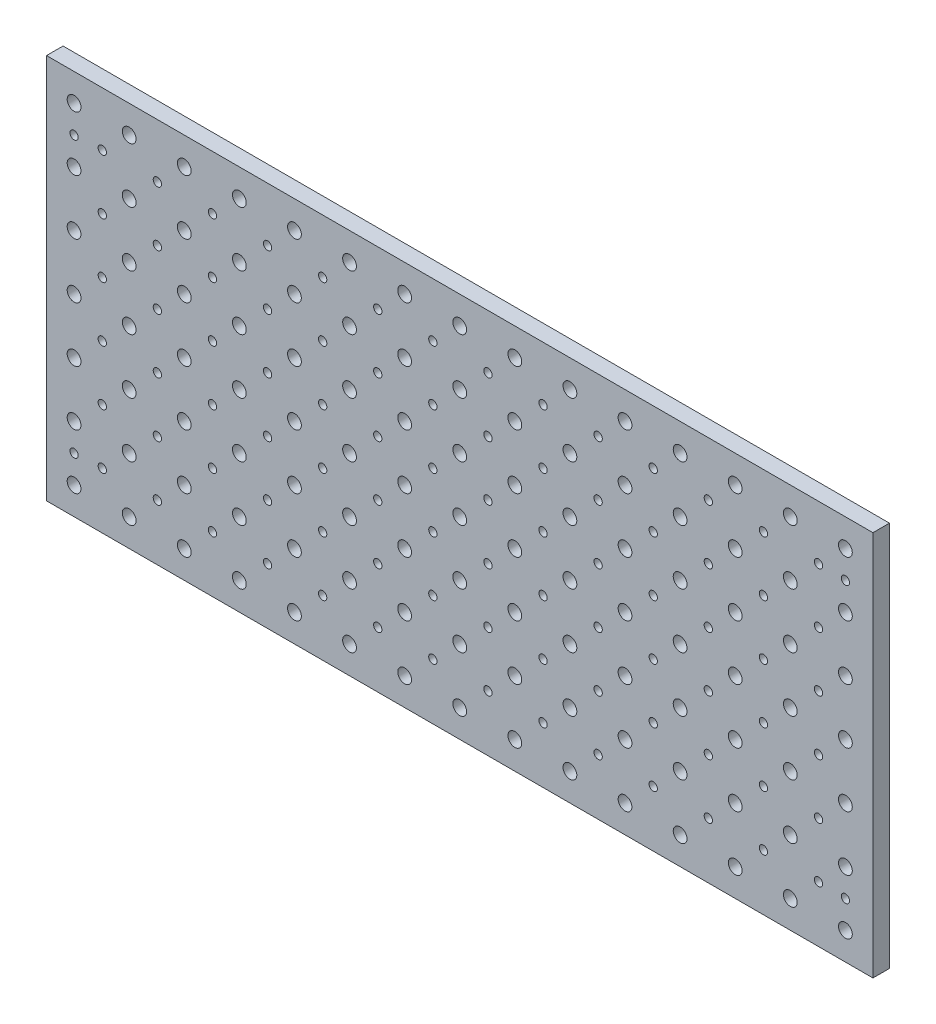
from build123d import *

# Parameters (mm, degrees)
SKIZZE1_W                       = 300
SKIZZE1_H                       = 140
AUFSATZ_LINEAR_AUSTRAGEN2_DEPTH = 6
SKIZZE2_R                       = 2.5
SCHNITT_LINEAR_AUSTRAGEN1_DEPTH = 6
LINEARES_MUSTER1_COUNT          = 15
LINEARES_MUSTER1_PITCH          = 20
LINEARES_MUSTER1_COUNT_DIR2     = 7
LINEARES_MUSTER1_PITCH_DIR2     = 20
SKIZZE4_R                       = 1.51
SCHNITT_LINEAR_AUSTRAGEN2_DEPTH = 6
LINEARES_MUSTER2_COUNT          = 14
LINEARES_MUSTER2_PITCH          = 20
LINEARES_MUSTER2_COUNT_DIR2     = 6
LINEARES_MUSTER2_PITCH_DIR2     = 20
SKIZZE5_R                       = 1.5
SCHNITT_LINEAR_AUSTRAGEN3_DEPTH = 10
LINEARES_MUSTER3_COUNT          = 2
LINEARES_MUSTER3_PITCH          = 280
LINEARES_MUSTER3_COUNT_DIR2     = 2
LINEARES_MUSTER3_PITCH_DIR2     = 100


with BuildPart() as part:
    # Skizze1 → Aufsatz-Linear austragen2 (new body)
    with BuildSketch(Plane.XY):
        Rectangle(SKIZZE1_W, SKIZZE1_H)
    extrude(amount=AUFSATZ_LINEAR_AUSTRAGEN2_DEPTH)

    # Skizze2 → Schnitt-Linear austragen1 (cut)
    with BuildSketch(Plane(origin=(0, 0, 0), x_dir=(-1, 0, 0), z_dir=(0, 0, -1))):
        with Locations((-140, 60)):
            Circle(SKIZZE2_R)
    schnitt_linear_austragen1 = extrude(amount=-SCHNITT_LINEAR_AUSTRAGEN1_DEPTH, mode=Mode.SUBTRACT)

    # Lineares Muster1: Schnitt-Linear austragen1 15 × 7
    with Locations(*[(-i * LINEARES_MUSTER1_PITCH, -j * LINEARES_MUSTER1_PITCH_DIR2, 0) for i in range(LINEARES_MUSTER1_COUNT) for j in range(LINEARES_MUSTER1_COUNT_DIR2) if (i, j) != (0, 0)]):
        add(schnitt_linear_austragen1, mode=Mode.SUBTRACT)

    # Skizze4 → Schnitt-Linear austragen2 (cut)
    with BuildSketch(Plane(origin=(0, 0, 0), x_dir=(-1, 0, 0), z_dir=(0, 0, -1))):
        with Locations((-130.241738806, 50.3739212)):
            Circle(SKIZZE4_R)
    schnitt_linear_austragen2 = extrude(amount=-SCHNITT_LINEAR_AUSTRAGEN2_DEPTH, mode=Mode.SUBTRACT)

    # Lineares Muster2: Schnitt-Linear austragen2 14 × 6
    with Locations(*[(-i * LINEARES_MUSTER2_PITCH, -j * LINEARES_MUSTER2_PITCH_DIR2, 0) for i in range(LINEARES_MUSTER2_COUNT) for j in range(LINEARES_MUSTER2_COUNT_DIR2) if (i, j) != (0, 0)]):
        add(schnitt_linear_austragen2, mode=Mode.SUBTRACT)

    # Skizze5 → Schnitt-Linear austragen3 (cut)
    with BuildSketch(Plane(origin=(0, 0, 0), x_dir=(-1, 0, 0), z_dir=(0, 0, -1))):
        with Locations((-140, 50)):
            Circle(SKIZZE5_R)
    schnitt_linear_austragen3 = extrude(amount=-SCHNITT_LINEAR_AUSTRAGEN3_DEPTH, mode=Mode.SUBTRACT)

    # Lineares Muster3: Schnitt-Linear austragen3 2 × 2
    with Locations(*[(-i * LINEARES_MUSTER3_PITCH, -j * LINEARES_MUSTER3_PITCH_DIR2, 0) for i in range(LINEARES_MUSTER3_COUNT) for j in range(LINEARES_MUSTER3_COUNT_DIR2) if (i, j) != (0, 0)]):
        add(schnitt_linear_austragen3, mode=Mode.SUBTRACT)


solid = part.part
